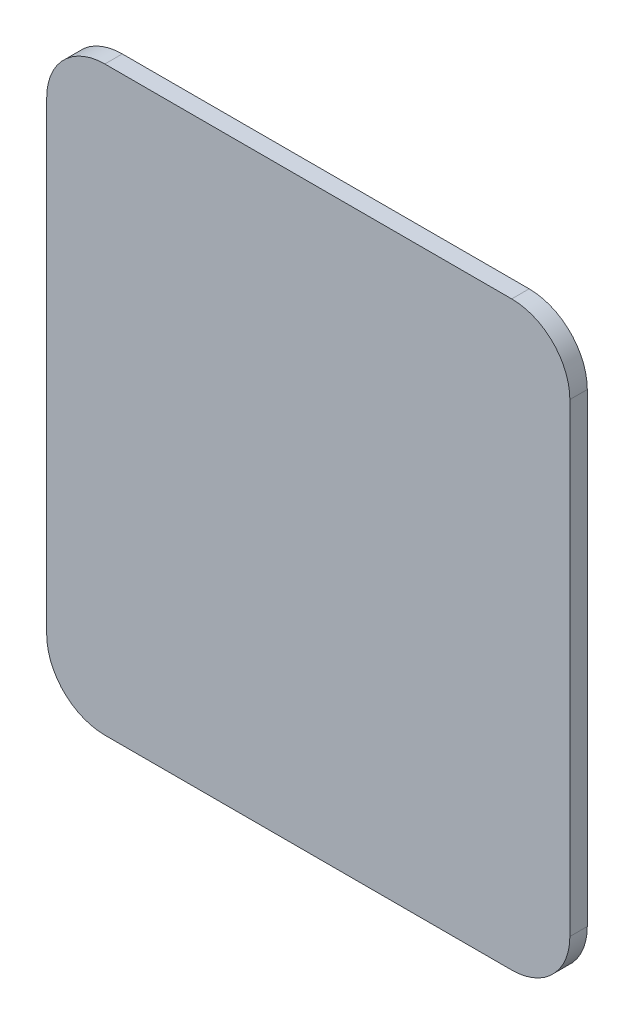
from build123d import *

# Parameters (mm, degrees)
SKETCH1_W           = 90
SKETCH1_H           = 100
BOSS_EXTRUDE1_DEPTH = 3
FILLET1_R           = 10
FILLET2_R           = 10
FILLET3_R           = 10
FILLET4_R           = 10


with BuildPart() as part:
    # Sketch1 → Boss-Extrude1 (new body)
    with BuildSketch(Plane.XY):
        with Locations((18.212919511, -30.337376221)):
            Rectangle(SKETCH1_W, SKETCH1_H)
    extrude(amount=BOSS_EXTRUDE1_DEPTH)

    # Fillet1
    fillet1_edges = [part.edges().sort_by_distance(p)[0] for p in [
        (63.212919511, 19.662623779, 1.5),
    ]]
    fillet(fillet1_edges, radius=FILLET1_R)

    # Fillet2
    fillet2_edges = [part.edges().sort_by_distance(p)[0] for p in [
        (-26.787080489, 19.662623779, 1.5),
    ]]
    fillet(fillet2_edges, radius=FILLET2_R)

    # Fillet3
    fillet3_edges = [part.edges().sort_by_distance(p)[0] for p in [
        (-26.787080489, -80.337376221, 1.5),
    ]]
    fillet(fillet3_edges, radius=FILLET3_R)

    # Fillet4
    fillet4_edges = [part.edges().sort_by_distance(p)[0] for p in [
        (63.212919511, -80.337376221, 1.5),
    ]]
    fillet(fillet4_edges, radius=FILLET4_R)


solid = part.part
